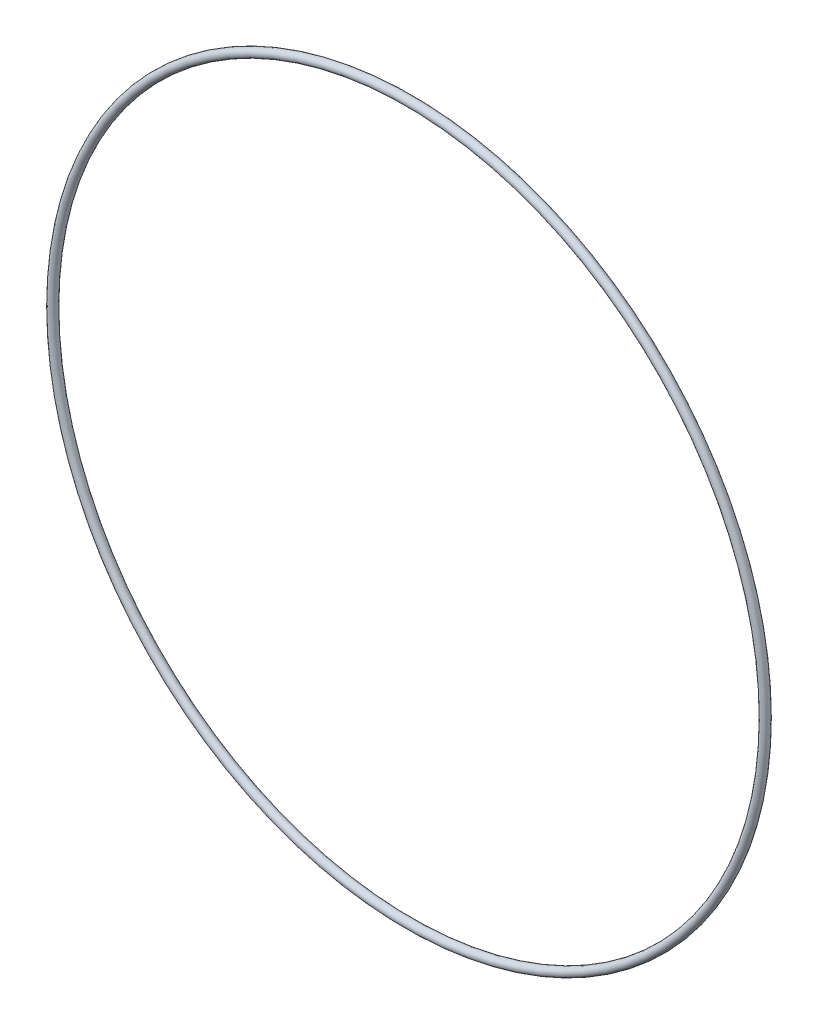
from build123d import *

# Parameters (mm, degrees)
SKETCH6_R = 1.5


with BuildPart() as part:
    # Sketch6 → Revolve1 (revolve)
    with BuildSketch(Plane(origin=(0, 0, 0), x_dir=(0, 0, -1), z_dir=(1, 0, 0)), mode=Mode.PRIVATE) as revolve1_sk:
        with Locations((0, 124)):
            Circle(SKETCH6_R)
    revolve(revolve1_sk.sketch.rotate(Axis((0, 0, -8.513816688), (0, 0, 1)), 90), axis=Axis((0, 0, -8.513816688), (0, 0, 1)))


solid = part.part
